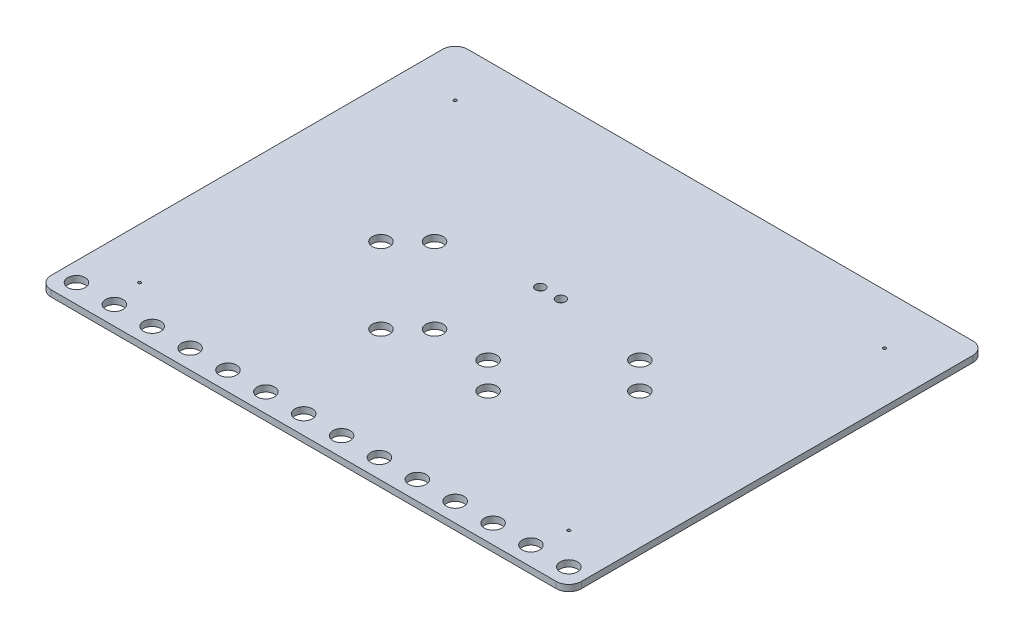
from build123d import *

# Parameters (mm, degrees)
SKETCH1_W           = 533.4
SKETCH1_H           = 419.1
BOSS_EXTRUDE1_DEPTH = 3.175
SKETCH2_R           = 4.4196
CUT_EXTRUDE1_DEPTH  = 340.235043886
SKETCH3_R           = 8.73125
CUT_EXTRUDE2_DEPTH  = 340.235043886
FILLET1_R           = 12.7
SKETCH5_R           = 1.5367
CUT_EXTRUDE4_DEPTH  = 340.235043886
SKETCH6_R           = 4.7625
CUT_EXTRUDE5_DEPTH  = 340.235043886
SKETCH7_R           = 8.73125
CUT_EXTRUDE6_DEPTH  = 340.235043886


with BuildPart() as part:
    # Sketch1 → Boss-Extrude1 (new, symmetric)
    with BuildSketch(Plane(origin=(0, 0, 0), x_dir=(1, 0, 0), z_dir=(0, 1, 0))):
        Rectangle(SKETCH1_W, SKETCH1_H)
    extrude(amount=BOSS_EXTRUDE1_DEPTH, both=True)

    # Sketch2 → Cut-Extrude1 (cut, through all)
    with BuildSketch(Plane(origin=(0, 3.175, 0), x_dir=(1, 0, 0), z_dir=(0, 1, 0))):
        with Locations(Location((-209.55, -190.5, 0), (0, 0, 270))):
            Circle(SKETCH2_R)
        with Locations(Location((-171.45, -190.5, 0), (0, 0, 270))):
            Circle(SKETCH2_R)
        with Locations(Location((-133.35, -190.5, 0), (0, 0, 270))):
            Circle(SKETCH2_R)
        with Locations(Location((-95.25, -190.5, 0), (0, 0, 270))):
            Circle(SKETCH2_R)
        with Locations(Location((-57.15, -190.5, 0), (0, 0, 270))):
            Circle(SKETCH2_R)
        with Locations(Location((-19.05, -190.5, 0), (0, 0, 270))):
            Circle(SKETCH2_R)
        with Locations(Location((19.05, -190.5, 0), (0, 0, 270))):
            Circle(SKETCH2_R)
        with Locations(Location((-247.65, -190.5, 0), (0, 0, 270))):
            Circle(SKETCH2_R)
        with Locations(Location((57.15, -190.5, 0), (0, 0, 270))):
            Circle(SKETCH2_R)
        with Locations(Location((95.25, -190.5, 0), (0, 0, 270))):
            Circle(SKETCH2_R)
        with Locations(Location((133.35, -190.5, 0), (0, 0, 270))):
            Circle(SKETCH2_R)
        with Locations(Location((171.45, -190.5, 0), (0, 0, 270))):
            Circle(SKETCH2_R)
        with Locations(Location((209.55, -190.5, 0), (0, 0, 270))):
            Circle(SKETCH2_R)
        with Locations(Location((247.65, -190.5, 0), (0, 0, 270))):
            Circle(SKETCH2_R)
        with Locations((285.75, -190.5)):
            Circle(SKETCH2_R)
    extrude(amount=-CUT_EXTRUDE1_DEPTH, mode=Mode.SUBTRACT)

    # Sketch3 → Cut-Extrude2 (cut, through all)
    with BuildSketch(Plane(origin=(0, 3.175, 0), x_dir=(1, 0, 0), z_dir=(0, 1, 0))):
        with Locations(Location((-247.65, -190.5, 0), (0, 0, 270))):
            Circle(SKETCH3_R)
        with Locations(Location((-209.55, -190.5, 0), (0, 0, 270))):
            Circle(SKETCH3_R)
        with Locations(Location((-171.45, -190.5, 0), (0, 0, 270))):
            Circle(SKETCH3_R)
        with Locations(Location((-133.35, -190.5, 0), (0, 0, 270))):
            Circle(SKETCH3_R)
        with Locations(Location((-95.25, -190.5, 0), (0, 0, 270))):
            Circle(SKETCH3_R)
        with Locations(Location((-57.15, -190.5, 0), (0, 0, 270))):
            Circle(SKETCH3_R)
        with Locations(Location((-19.05, -190.5, 0), (0, 0, 270))):
            Circle(SKETCH3_R)
        with Locations(Location((19.05, -190.5, 0), (0, 0, 270))):
            Circle(SKETCH3_R)
        with Locations(Location((57.15, -190.5, 0), (0, 0, 270))):
            Circle(SKETCH3_R)
        with Locations(Location((95.25, -190.5, 0), (0, 0, 270))):
            Circle(SKETCH3_R)
        with Locations(Location((133.35, -190.5, 0), (0, 0, 270))):
            Circle(SKETCH3_R)
        with Locations(Location((171.45, -190.5, 0), (0, 0, 270))):
            Circle(SKETCH3_R)
        with Locations(Location((209.55, -190.5, 0), (0, 0, 270))):
            Circle(SKETCH3_R)
        with Locations(Location((247.65, -190.5, 0), (0, 0, 270))):
            Circle(SKETCH3_R)
        with Locations((285.75, -190.5)):
            Circle(SKETCH3_R)
    extrude(amount=-CUT_EXTRUDE2_DEPTH, mode=Mode.SUBTRACT)

    # Fillet1
    fillet1_edges = [part.edges().sort_by_distance(p)[0] for p in [
        (266.7, 0, 209.55),
        (-266.7, 0, 209.55),
        (-266.7, 0, -209.55),
        (266.7, 0, -209.55),
    ]]
    fillet(fillet1_edges, radius=FILLET1_R)

    # Sketch5 → Cut-Extrude4 (cut, through all)
    with BuildSketch(Plane(origin=(0, 3.175, 0), x_dir=(1, 0, 0), z_dir=(0, 1, 0))):
        with Locations(Location((-215.9, 158.75, 0), (0, 0, 270))):
            Circle(SKETCH5_R)
        with Locations(Location((215.9, 158.75, 0), (0, 0, 270))):
            Circle(SKETCH5_R)
        with Locations(Location((215.9, -158.75, 0), (0, 0, 270))):
            Circle(SKETCH5_R)
        with Locations(Location((-215.9, -158.75, 0), (0, 0, 270))):
            Circle(SKETCH5_R)
    extrude(amount=-CUT_EXTRUDE4_DEPTH, mode=Mode.SUBTRACT)

    # Sketch6 → Cut-Extrude5 (cut, through all)
    with BuildSketch(Plane(origin=(0, 3.175, 0), x_dir=(1, 0, 0), z_dir=(0, 1, 0))):
        with Locations(Location((-10.31875, 38.815634586, 0), (0, 0, 270))):
            Circle(SKETCH6_R)
        with Locations(Location((10.31875, 38.815634586, 0), (0, 0, 270))):
            Circle(SKETCH6_R)
    extrude(amount=-CUT_EXTRUDE5_DEPTH, mode=Mode.SUBTRACT)

    # Sketch7 → Cut-Extrude6 (cut, through all)
    with BuildSketch(Plane(origin=(0, 3.175, 0), x_dir=(1, 0, 0), z_dir=(0, 1, 0))):
        with Locations(Location((-103.272945392, 25.345250482, 0), (0, 0, 270))):
            Circle(SKETCH7_R)
        with Locations(Location((-130.213713756, -1.595517881, 0), (0, 0, 270))):
            Circle(SKETCH7_R)
        with Locations(Location((-53.881536726, -77.92769491, 0), (0, 0, 270))):
            Circle(SKETCH7_R)
        with Locations(Location((-26.940768363, -50.986926547, 0), (0, 0, 270))):
            Circle(SKETCH7_R)
        with Locations(Location((26.940768363, -50.986926547, 0), (0, 0, 270))):
            Circle(SKETCH7_R)
        with Locations(Location((53.881536726, -77.92769491, 0), (0, 0, 270))):
            Circle(SKETCH7_R)
        with Locations(Location((130.213713756, -1.595517881, 0), (0, 0, 270))):
            Circle(SKETCH7_R)
        with Locations(Location((103.272945392, 25.345250482, 0), (0, 0, 270))):
            Circle(SKETCH7_R)
    extrude(amount=-CUT_EXTRUDE6_DEPTH, mode=Mode.SUBTRACT)


solid = part.part
